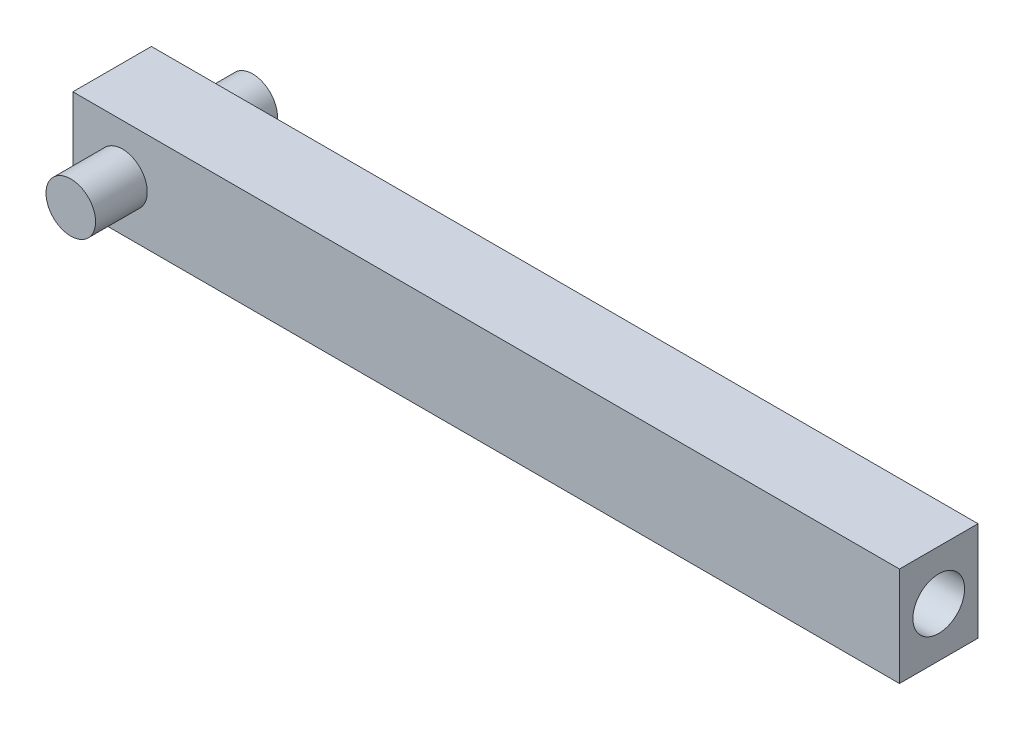
from build123d import *

# Parameters (mm, degrees)
SKETCH1_W           = 400
SKETCH1_H           = 38
BOSS_EXTRUDE1_DEPTH = 48
SKETCH2_R           = 12
BOSS_EXTRUDE2_DEPTH = 25
BOSS_EXTRUDE3_START = 25
SKETCH3_R           = 12
BOSS_EXTRUDE3_DEPTH = 25
SKETCH6_R           = 12.5
CUT_EXTRUDE1_DEPTH  = 50


with BuildPart() as part:
    # Sketch1 → Boss-Extrude1 (new body)
    with BuildSketch(Plane(origin=(0, 0, 0), x_dir=(1, 0, 0), z_dir=(0, 1, 0))):
        Rectangle(SKETCH1_W, SKETCH1_H)
    extrude(amount=BOSS_EXTRUDE1_DEPTH)

    # Sketch2 → Boss-Extrude2 (add)
    with BuildSketch(Plane.XY.offset(19)):
        with Locations(Location((-176, 24, 0), (0, 0, 180))):
            Circle(SKETCH2_R)
    extrude(amount=BOSS_EXTRUDE2_DEPTH)

    # Sketch3 → Boss-Extrude3 (add)
    with BuildSketch(Plane(origin=(0, 0, -19), x_dir=(-1, 0, 0), z_dir=(0, 0, -1)).offset(BOSS_EXTRUDE3_START)):
        with Locations((176, 24)):
            Circle(SKETCH3_R)
    extrude(amount=-BOSS_EXTRUDE3_DEPTH)

    # Sketch6 → Cut-Extrude1 (cut)
    with BuildSketch(Plane(origin=(200, 0, 0), x_dir=(0, 0, -1), z_dir=(1, 0, 0))):
        with Locations((0, 24)):
            Circle(SKETCH6_R)
    extrude(amount=-CUT_EXTRUDE1_DEPTH, mode=Mode.SUBTRACT)


solid = part.part
